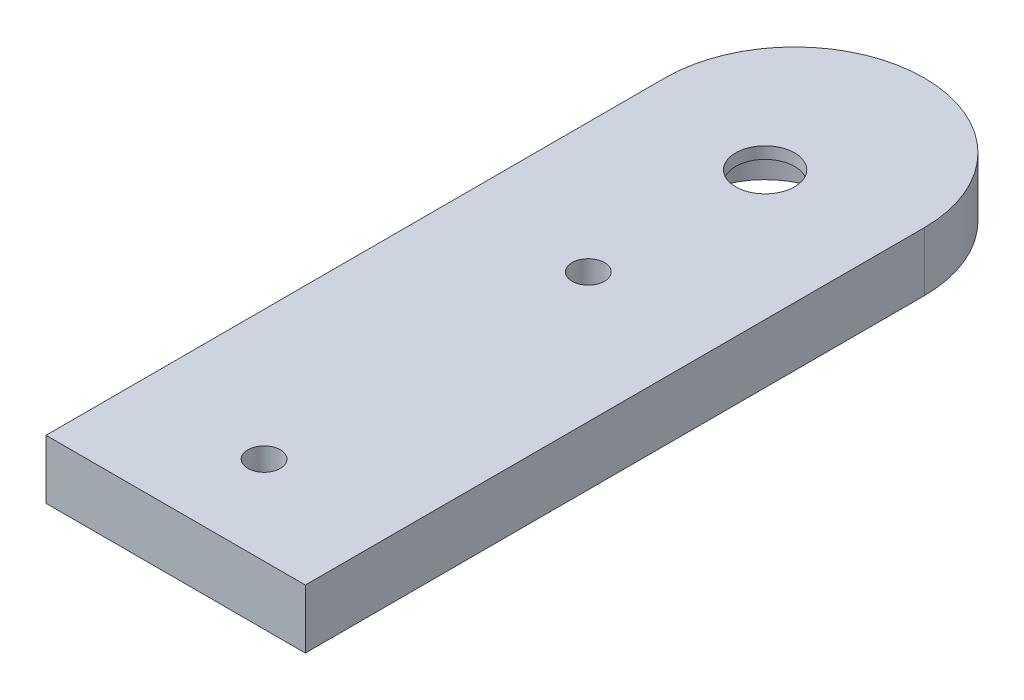
from build123d import *

# Parameters (mm, degrees)
SKETCH1_R           = 2.75
SKETCH1_R_2         = 12.1
BOSS_EXTRUDE1_DEPTH = 8
SKETCH2_R           = 2.75
SKETCH2_R_2         = 5
BOSS_EXTRUDE2_DEPTH = 2


with BuildPart() as part:
    # Sketch1 → Boss-Extrude1 (new body)
    with BuildSketch(Plane(origin=(0, 0, 0), x_dir=(1, 0, 0), z_dir=(0, 1, 0))):
        with BuildLine():
            Line((-22, 63.5), (-22, 41.5))
            Line((-22, 41.5), (-22, -41.5))
            Line((-22, -41.5), (22, -41.5))
            Line((22, -41.5), (22, 41.5))
            Line((22, 41.5), (22, 63.5))
            ThreePointArc((22, 63.5), (0, 85.5), (-22, 63.5))
        make_face()
        with Locations(Location((0, -26.5, 0), (0, 0, 270))):
            Circle(SKETCH1_R, mode=Mode.SUBTRACT)
        with Locations(Location((0, 58.5, 0), (0, 0, 270))):
            Circle(SKETCH1_R_2, mode=Mode.SUBTRACT)
        with Locations(Location((0, 28.5, 0), (0, 0, 270))):
            Circle(SKETCH1_R, mode=Mode.SUBTRACT)
    extrude(amount=BOSS_EXTRUDE1_DEPTH)

    # Sketch2 → Boss-Extrude2 (add)
    with BuildSketch(Plane(origin=(0, 8, 0), x_dir=(1, 0, 0), z_dir=(0, 1, 0))):
        with BuildLine():
            Line((-22, -41.5), (22, -41.5))
            Line((22, -41.5), (22, 63.5))
            ThreePointArc((22, 63.5), (0, 85.5), (-22, 63.5))
            Line((-22, 63.5), (-22, -41.5))
        make_face()
        with Locations(Location((0, 28.5, 0), (0, 0, 270))):
            Circle(SKETCH2_R, mode=Mode.SUBTRACT)
        with Locations(Location((0, -26.5, 0), (0, 0, 270))):
            Circle(SKETCH2_R, mode=Mode.SUBTRACT)
        with Locations(Location((0, 58.5, 0), (0, 0, 270))):
            Circle(SKETCH2_R_2, mode=Mode.SUBTRACT)
    extrude(amount=BOSS_EXTRUDE2_DEPTH)


solid = part.part
